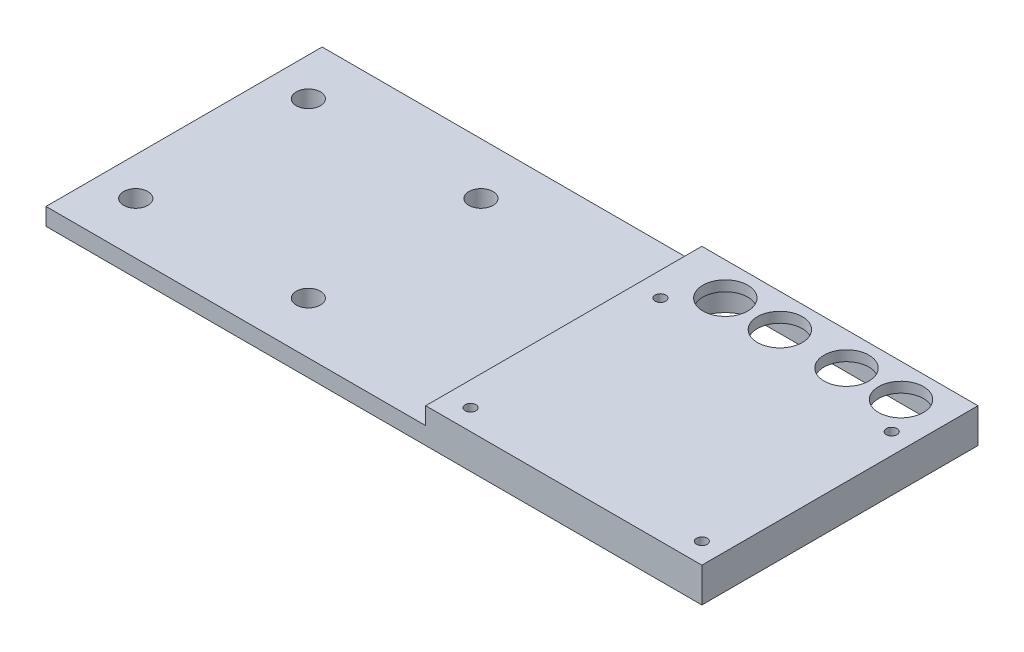
from build123d import *

# Parameters (mm, degrees)
SKETCH1_W           = 190
SKETCH1_H           = 80
BOSS_EXTRUDE1_DEPTH = 5
SKETCH3_W           = 80
SKETCH3_H           = 80
BOSS_EXTRUDE2_DEPTH = 5
SKETCH4_R           = 1.55
CUT_EXTRUDE1_DEPTH  = 104.561575886
SKETCH5_R           = 6.5
CUT_EXTRUDE2_DEPTH  = 104.561575886
CUT_EXTRUDE3_DEPTH  = 7
SKETCH7_R           = 3.5
CUT_EXTRUDE4_DEPTH  = 104.561575886


with BuildPart() as part:
    # Sketch1 → Boss-Extrude1 (new body)
    with BuildSketch(Plane(origin=(0, 0, 0), x_dir=(1, 0, 0), z_dir=(0, 1, 0))):
        Rectangle(SKETCH1_W, SKETCH1_H)
    extrude(amount=BOSS_EXTRUDE1_DEPTH)

    # Sketch3 → Boss-Extrude2 (add)
    with BuildSketch(Plane(origin=(0, 5, 0), x_dir=(1, 0, 0), z_dir=(0, 1, 0))):
        with Locations((55, 0)):
            Rectangle(SKETCH3_W, SKETCH3_H)
    extrude(amount=BOSS_EXTRUDE2_DEPTH)

    # Sketch4 → Cut-Extrude1 (cut, through all)
    with BuildSketch(Plane(origin=(0, 10, 0), x_dir=(1, 0, 0), z_dir=(0, 1, 0))):
        with Locations(Location((22, 21, 0), (0, 0, 270))):
            Circle(SKETCH4_R)
        with Locations(Location((89, 21, 0), (0, 0, 270))):
            Circle(SKETCH4_R)
        with Locations(Location((22, -34, 0), (0, 0, 270))):
            Circle(SKETCH4_R)
        with Locations(Location((89, -34, 0), (0, 0, 270))):
            Circle(SKETCH4_R)
    extrude(amount=-CUT_EXTRUDE1_DEPTH, mode=Mode.SUBTRACT)

    # Sketch5 → Cut-Extrude2 (cut, through all)
    with BuildSketch(Plane.XZ):
        with Locations(Location((31.4, -30.4, 0), (0, 0, 270))):
            Circle(SKETCH5_R)
        with Locations(Location((47.2, -30.4, 0), (0, 0, 270))):
            Circle(SKETCH5_R)
        with Locations(Location((66.5, -30.4, 0), (0, 0, 270))):
            Circle(SKETCH5_R)
        with Locations(Location((82.3, -30.4, 0), (0, 0, 270))):
            Circle(SKETCH5_R)
    extrude(amount=-CUT_EXTRUDE2_DEPTH, mode=Mode.SUBTRACT)

    # Sketch6 → Cut-Extrude3 (cut)
    with BuildSketch(Plane.XZ):
        with BuildLine():
            Line((31.4, -21.4), (82.3, -21.4))
            ThreePointArc((82.3, -21.4), (91.3, -30.4), (82.3, -39.4))
            Line((82.3, -39.4), (31.4, -39.4))
            ThreePointArc((31.4, -39.4), (22.4, -30.4), (31.4, -21.4))
        make_face()
    extrude(amount=-CUT_EXTRUDE3_DEPTH, mode=Mode.SUBTRACT)

    # Sketch7 → Cut-Extrude4 (cut, through all)
    with BuildSketch(Plane.XZ):
        with Locations(Location((-84, 25, 0), (0, 0, 270))):
            Circle(SKETCH7_R)
        with Locations(Location((-34, 25, 0), (0, 0, 270))):
            Circle(SKETCH7_R)
        with Locations(Location((-84, -25, 0), (0, 0, 270))):
            Circle(SKETCH7_R)
        with Locations(Location((-34, -25, 0), (0, 0, 270))):
            Circle(SKETCH7_R)
    extrude(amount=-CUT_EXTRUDE4_DEPTH, mode=Mode.SUBTRACT)


solid = part.part
